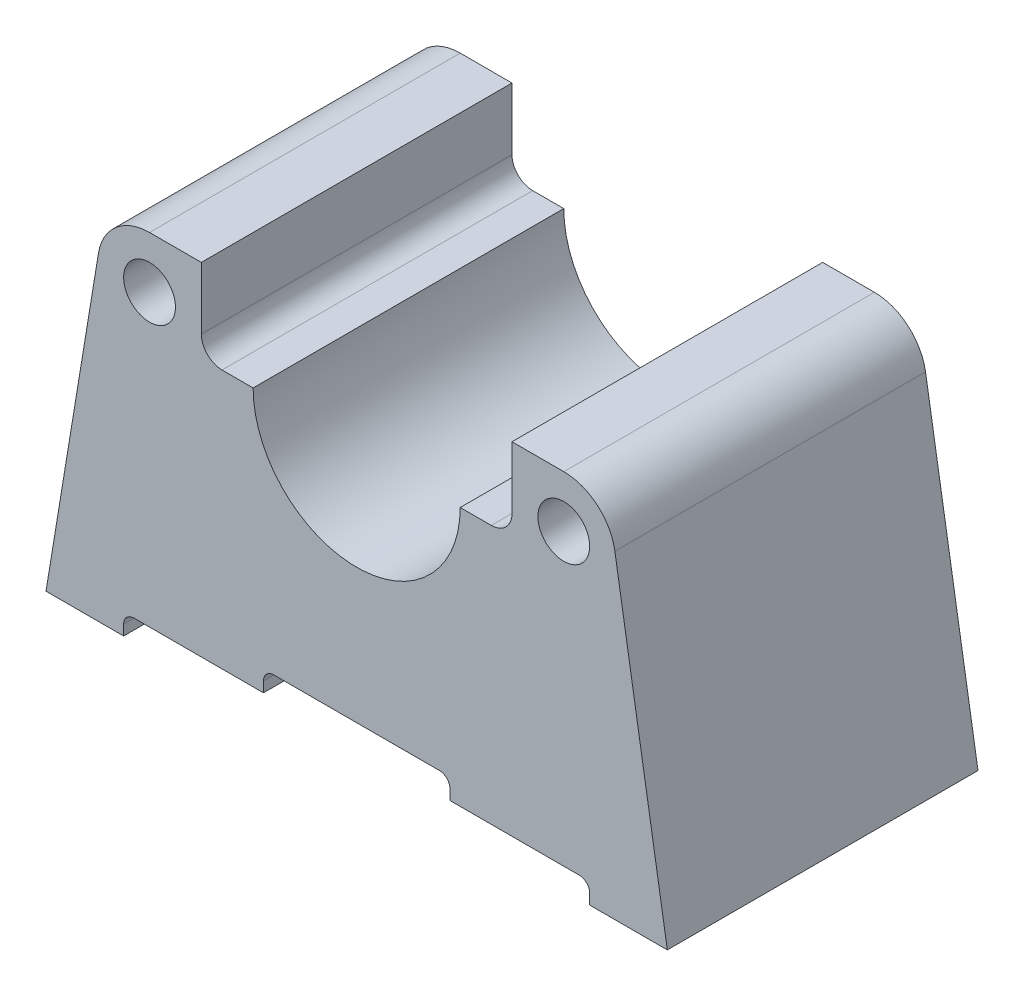
from build123d import *

# Parameters (mm, degrees)
SKETCH1_R           = 2.5
BOSS_EXTRUDE1_DEPTH = 30


with BuildPart() as part:
    # Sketch1 → Boss-Extrude1 (new body)
    with BuildSketch(Plane.XY):
        with BuildLine():
            Line((-8, 4), (8, 4))
            ThreePointArc((8, 4), (8.707106781, 3.707106781), (9, 3))
            Line((9, 3), (9, 2))
            Line((9, 2), (21.5, 2))
            ThreePointArc((21.5, 2), (22.207106781, 1.707106781), (22.5, 1))
            Line((22.5, 1), (22.5, 0))
            Line((22.5, 0), (30, 0))
            Line((30, 0), (24.933748499, 30.8112495))
            ThreePointArc((24.933748499, 30.8112495), (23.236027851, 33.811577593), (20, 35))
            Line((20, 35), (15, 35))
            Line((15, 35), (15, 29))
            ThreePointArc((15, 29), (14.414213562, 27.585786438), (13, 27))
            Line((13, 27), (10, 27))
            ThreePointArc((10, 27), (0, 17), (-10, 27))
            Line((-10, 27), (-13, 27))
            ThreePointArc((-13, 27), (-14.414213562, 27.585786438), (-15, 29))
            Line((-15, 29), (-15, 35))
            Line((-15, 35), (-20, 35))
            ThreePointArc((-20, 35), (-23.236027851, 33.811577593), (-24.933748499, 30.8112495))
            Line((-24.933748499, 30.8112495), (-30, 0))
            Line((-30, 0), (-22.5, 0))
            Line((-22.5, 0), (-22.5, 1))
            ThreePointArc((-22.5, 1), (-22.207106781, 1.707106781), (-21.5, 2))
            Line((-21.5, 2), (-9, 2))
            Line((-9, 2), (-9, 3))
            ThreePointArc((-9, 3), (-8.707106781, 3.707106781), (-8, 4))
        make_face()
        with Locations((-20, 30)):
            Circle(SKETCH1_R, mode=Mode.SUBTRACT)
        with Locations((20, 30)):
            Circle(SKETCH1_R, mode=Mode.SUBTRACT)
    extrude(amount=BOSS_EXTRUDE1_DEPTH)


solid = part.part
